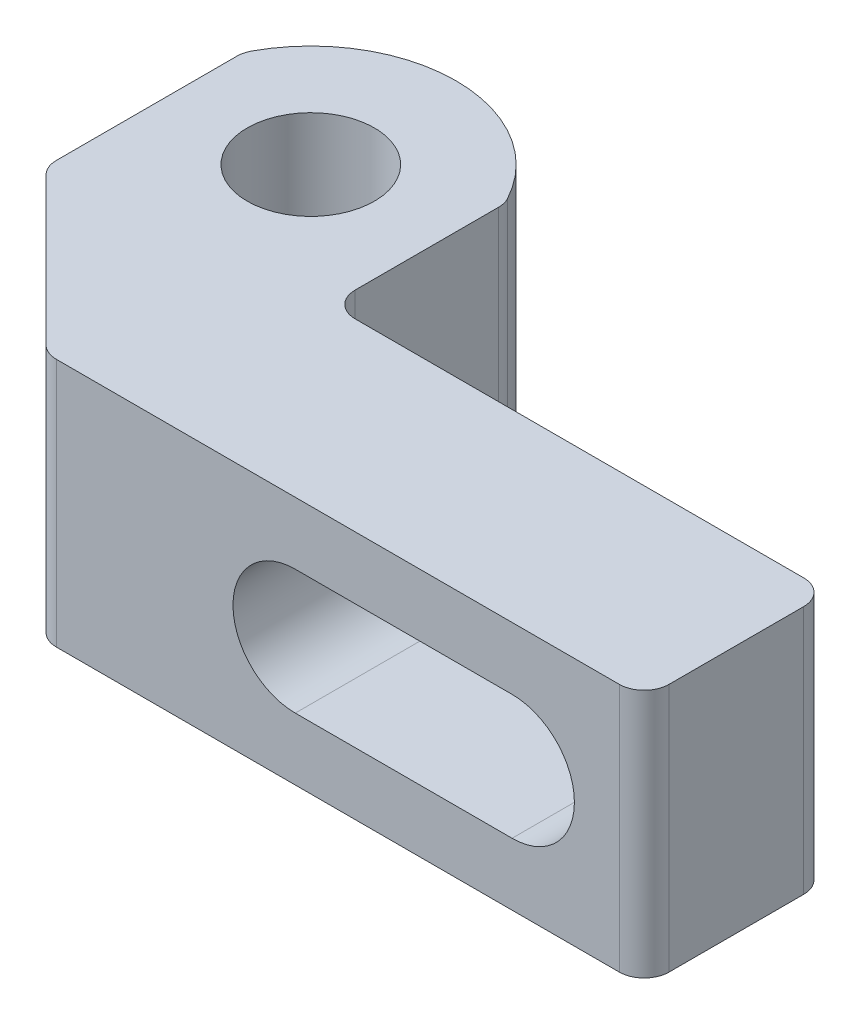
from build123d import *

# Parameters (mm, degrees)
SKETCH1_R           = 2.55
BOSS_EXTRUDE1_DEPTH = 10
CUT_EXTRUDE1_DEPTH  = 34.709642537
FILLET2_R           = 1


with BuildPart() as part:
    # Sketch1 → Boss-Extrude1 (new body)
    with BuildSketch(Plane(origin=(0, 0, 0), x_dir=(1, 0, 0), z_dir=(0, 1, 0))):
        with BuildLine():
            Line((0, 0), (0, 7.4))
            Line((0, 7.4), (-20, 7.4))
            Line((-20, 7.4), (-20, 14.4))
            ThreePointArc((-20, 14.4), (-25.25, 17.7), (-30.5, 14.4))
            Line((-30.5, 14.4), (-30.5, 6.5))
            Line((-30.5, 6.5), (-24, 0))
            Line((-24, 0), (0, 0))
        make_face()
        with Locations(Location((-25.25, 11.873863636, 0), (0, 0, 270))):
            Circle(SKETCH1_R, mode=Mode.SUBTRACT)
    extrude(amount=BOSS_EXTRUDE1_DEPTH)

    # Sketch3 → Cut-Extrude1 (cut, through all)
    with BuildSketch(Plane(origin=(0, 0, -7.4), x_dir=(-1, 0, 0), z_dir=(0, 0, -1))):
        with BuildLine():
            Line((14, 2.5), (5.3, 2.5))
            ThreePointArc((5.3, 2.5), (2.8, 5), (5.3, 7.5))
            Line((5.3, 7.5), (14, 7.5))
            ThreePointArc((14, 7.5), (16.5, 5), (14, 2.5))
        make_face()
    extrude(amount=-CUT_EXTRUDE1_DEPTH, mode=Mode.SUBTRACT)

    # Fillet2
    fillet2_edges = [part.edges().sort_by_distance(p)[0] for p in [
        (-24, 5, 0),
        (-30.5, 5, -6.5),
        (-30.5, 5, -14.4),
        (-20, 5, -14.4),
        (-20, 5, -7.4),
        (0, 5, -7.4),
        (0, 5, 0),
    ]]
    fillet(fillet2_edges, radius=FILLET2_R)


solid = part.part
